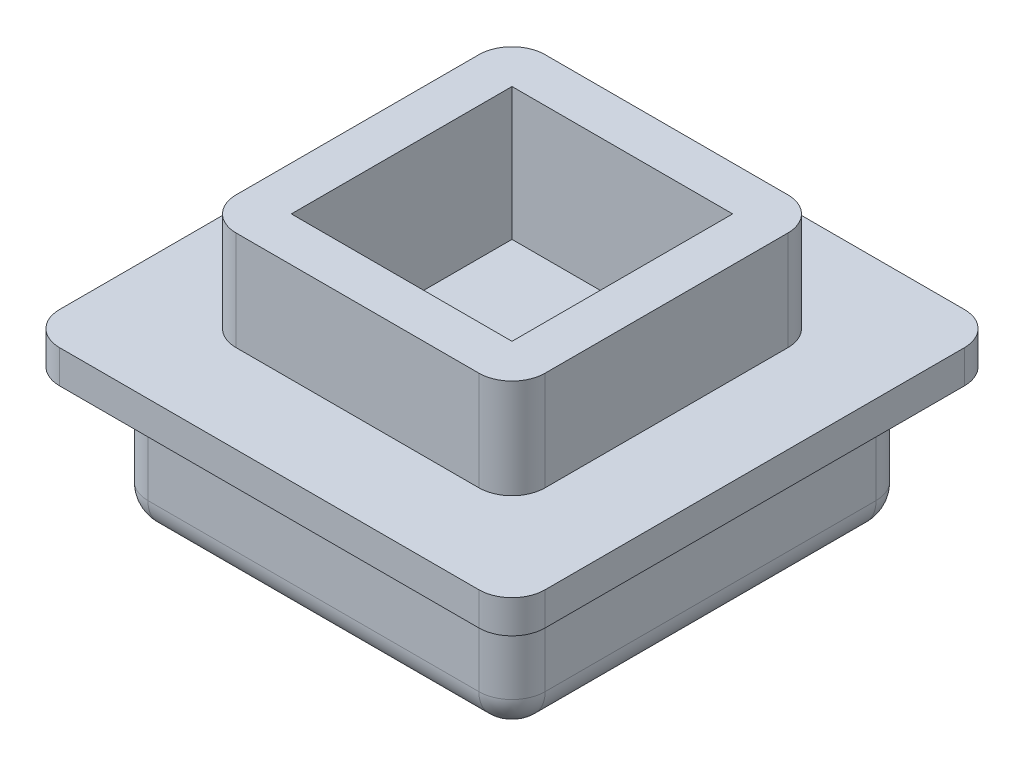
from build123d import *

# Parameters (mm, degrees)
SKETCH1_W           = 9
SKETCH1_H           = 9
BOSS_EXTRUDE1_DEPTH = 3
SKETCH2_W           = 11
SKETCH2_H           = 11
BOSS_EXTRUDE2_DEPTH = 0.75
SKETCH3_W           = 7
SKETCH3_H           = 7
SKETCH3_W_2         = 5
SKETCH3_H_2         = 5
BOSS_EXTRUDE3_DEPTH = 2.25
FILLET1_R           = 0.75
FILLET2_R           = 0.75
SKETCH4_W           = 5
SKETCH4_H           = 5
CUT_EXTRUDE1_DEPTH  = 0.75


with BuildPart() as part:
    # Sketch1 → Boss-Extrude1 (new body)
    with BuildSketch(Plane(origin=(0, 0, 0), x_dir=(1, 0, 0), z_dir=(0, 1, 0))):
        Rectangle(SKETCH1_W, SKETCH1_H)
    extrude(amount=BOSS_EXTRUDE1_DEPTH)

    # Sketch2 → Boss-Extrude2 (add)
    with BuildSketch(Plane(origin=(0, 3, 0), x_dir=(1, 0, 0), z_dir=(0, 1, 0))):
        Rectangle(SKETCH2_W, SKETCH2_H)
    extrude(amount=BOSS_EXTRUDE2_DEPTH)

    # Sketch3 → Boss-Extrude3 (add)
    with BuildSketch(Plane(origin=(0, 3.75, 0), x_dir=(1, 0, 0), z_dir=(0, 1, 0))):
        Rectangle(SKETCH3_W, SKETCH3_H)
        Rectangle(SKETCH3_W_2, SKETCH3_H_2, mode=Mode.SUBTRACT)
    extrude(amount=BOSS_EXTRUDE3_DEPTH)

    # Fillet1
    fillet1_edges = [part.edges().sort_by_distance(p)[0] for p in [
        (-5.5, 3.375, 5.5),
        (5.5, 3.375, 5.5),
        (5.5, 3.375, -5.5),
        (-5.5, 3.375, -5.5),
        (-3.5, 4.875, -3.5),
        (-3.5, 4.875, 3.5),
        (3.5, 4.875, 3.5),
        (3.5, 4.875, -3.5),
        (4.5, 1.5, 4.5),
        (-4.5, 1.5, 4.5),
        (-4.5, 1.5, -4.5),
        (4.5, 1.5, -4.5),
    ]]
    fillet(fillet1_edges, radius=FILLET1_R)

    # Fillet2
    fillet2_edges = [part.edges().sort_by_distance(p)[0] for p in [
        (0, 0, -4.5),
        (4.5, 0, 0),
        (0, 0, 4.5),
        (-4.5, 0, 0),
        (4.280330086, 0, 4.280330086),
        (-4.280330086, 0, 4.280330086),
        (-4.280330086, 0, -4.280330086),
        (4.280330086, 0, -4.280330086),
    ]]
    fillet(fillet2_edges, radius=FILLET2_R)

    # Sketch4 → Cut-Extrude1 (cut)
    with BuildSketch(Plane(origin=(0, 3.75, 0), x_dir=(1, 0, 0), z_dir=(0, 1, 0))):
        Rectangle(SKETCH4_W, SKETCH4_H)
    extrude(amount=-CUT_EXTRUDE1_DEPTH, mode=Mode.SUBTRACT)


solid = part.part
